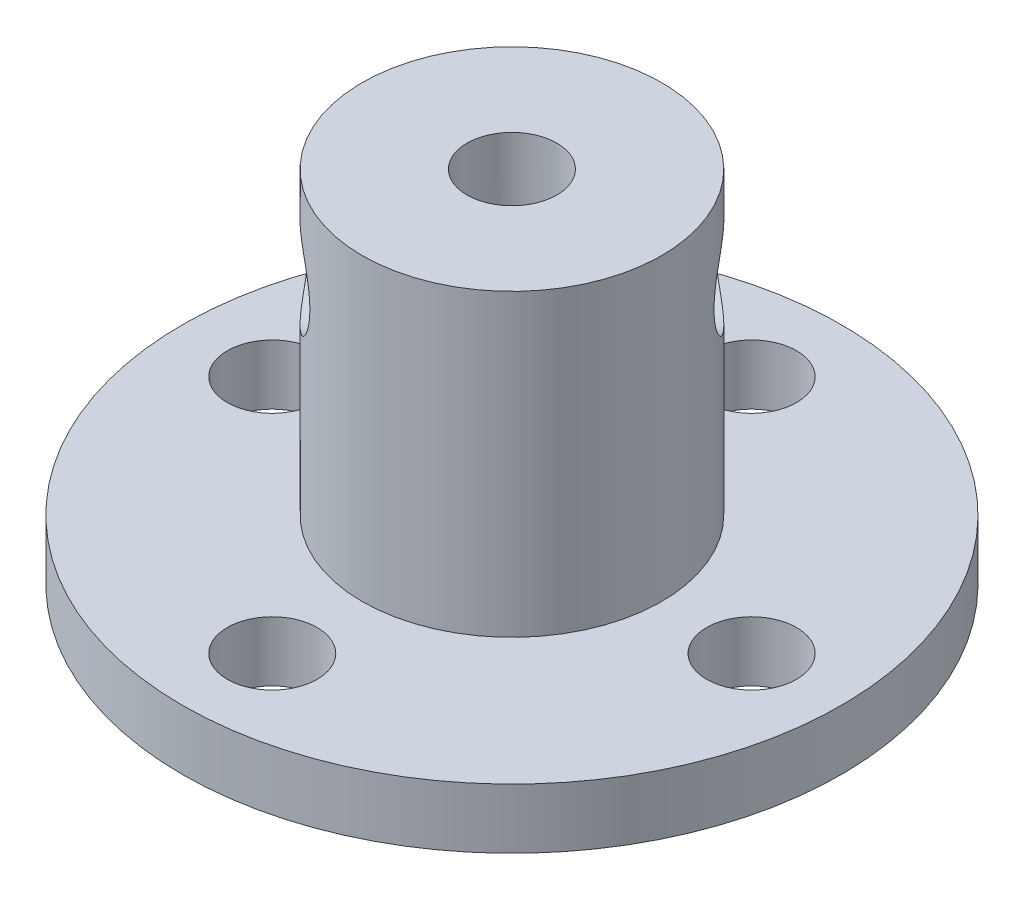
from build123d import *

# Parameters (mm, degrees)
SKETCH_1_R               = 11
SKETCH_1_R_2             = 1.5
EXTRUDE_1_DEPTH          = 2
SKETCH_2_R               = 5
EXTRUDE_2_DEPTH          = 10
SKETCH_3_R               = 1.5
CUT_EXTRUDE_1_DEPTH      = 20.646882704
CUT_EXTRUDE_2_DEPTH      = 20.646882704
CUT_EXTRUDE_2_DEPTH_BACK = 20.646882704
SKETCH_5_R               = 1.5


with BuildPart() as part:
    # 草圖1 → 填料-伸長1 (new body)
    with BuildSketch(Plane(origin=(0, 0, 0), x_dir=(1, 0, 0), z_dir=(0, 1, 0))):
        with Locations(Location((0, 0, 0), (0, 0, 270))):
            Circle(SKETCH_1_R)
        with Locations(Location((0, 8, 0), (0, 0, 270))):
            Circle(SKETCH_1_R_2, mode=Mode.SUBTRACT)
        with Locations(Location((8, 0, 0), (0, 0, 270))):
            Circle(SKETCH_1_R_2, mode=Mode.SUBTRACT)
        with Locations(Location((0, -8, 0), (0, 0, 270))):
            Circle(SKETCH_1_R_2, mode=Mode.SUBTRACT)
        with Locations(Location((-8, 0, 0), (0, 0, 270))):
            Circle(SKETCH_1_R_2, mode=Mode.SUBTRACT)
    extrude(amount=EXTRUDE_1_DEPTH)

    # 草圖2 → 填料-伸長2 (add)
    with BuildSketch(Plane(origin=(0, 2, 0), x_dir=(1, 0, 0), z_dir=(0, 1, 0))):
        with Locations(Location((0, 0, 0), (0, 0, 270))):
            Circle(SKETCH_2_R)
    extrude(amount=EXTRUDE_2_DEPTH)

    # 草圖3 → 除料-伸長1 (cut, through all)
    with BuildSketch(Plane(origin=(0, 12, 0), x_dir=(1, 0, 0), z_dir=(0, 1, 0))):
        with Locations(Location((0, 0, 0), (0, 0, 270))):
            Circle(SKETCH_3_R)
    extrude(amount=-CUT_EXTRUDE_1_DEPTH, mode=Mode.SUBTRACT)

    # 草圖5 → 除料-伸長2 (cut, two sides: drawn at the far end of the back side and taken through both)
    with BuildSketch(Plane(origin=(0, 0, 0), x_dir=(-0.7071067811865476, 0, -0.7071067811865476), z_dir=(0.7071067811865476, 0, -0.7071067811865476)).offset(-CUT_EXTRUDE_2_DEPTH_BACK)):
        with Locations((0, 9)):
            Circle(SKETCH_5_R)
    extrude(amount=CUT_EXTRUDE_2_DEPTH + CUT_EXTRUDE_2_DEPTH_BACK, mode=Mode.SUBTRACT)


solid = part.part
